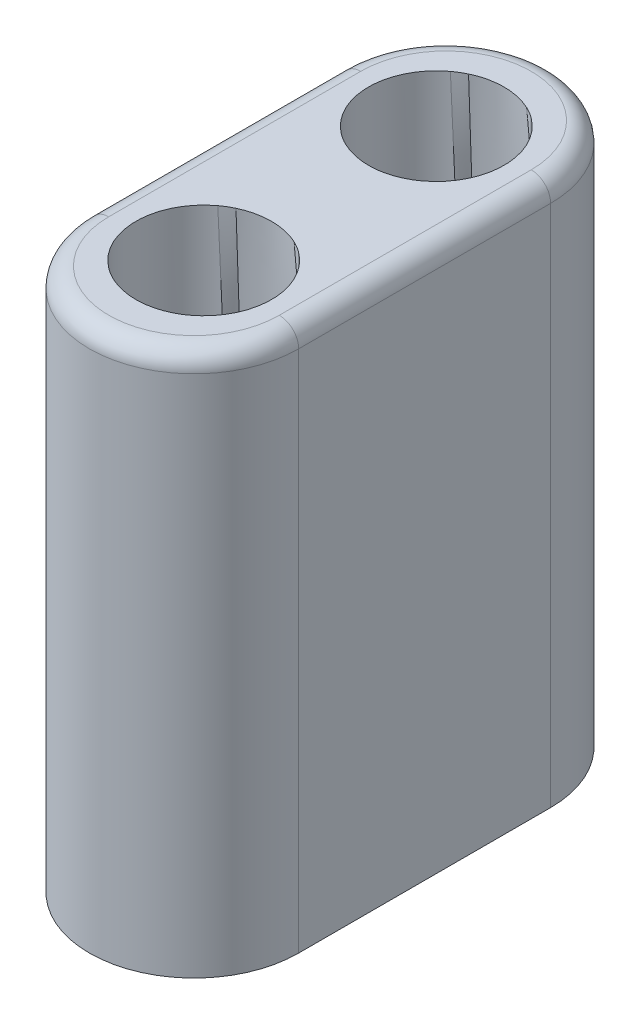
from build123d import *

# Parameters (mm, degrees)
BOSS_EXTRU_1_DEPTH      = 28
CONG_2_R                = 1
ESQUISSE3_R             = 3.5
ENL_V_MAT_EXTRU_3_DEPTH = 31.8993528
ESQUISSE6_W             = 3.6
ESQUISSE6_H             = 7.6
ENL_V_MAT_EXTRU_4_DEPTH = 23.243426154


with BuildPart() as part:
    # Esquisse1 → Boss.-Extru.1 (new body)
    with BuildSketch(Plane(origin=(0, 0, 0), x_dir=(1, 0, 0), z_dir=(0, 1, 0))):
        with BuildLine():
            Line((5.4, 6.5), (5.4, -6.5))
            ThreePointArc((5.4, -6.5), (0, -11.9), (-5.4, -6.5))
            Line((-5.4, -6.5), (-5.4, 6.5))
            ThreePointArc((-5.4, 6.5), (0, 11.9), (5.4, 6.5))
        make_face()
    extrude(amount=BOSS_EXTRU_1_DEPTH)

    # Congé2
    cong_2_edges = [part.edges().sort_by_distance(p)[0] for p in [
        (0, 28, 11.9),
        (5.4, 28, 0),
        (0, 28, -11.9),
        (-5.4, 28, 0),
    ]]
    fillet(cong_2_edges, radius=CONG_2_R)

    # Esquisse3 → Enlèv. mat.-Extru.3 (cut, through all)
    with BuildSketch(Plane(origin=(0, 28, 0), x_dir=(1, 0, 0), z_dir=(0, 1, 0))):
        with Locations(Location((0, -6, 0), (0, 0, 270))):
            Circle(ESQUISSE3_R)
    enl_v_mat_extru_3 = extrude(amount=-ENL_V_MAT_EXTRU_3_DEPTH, mode=Mode.SUBTRACT)

    # Esquisse5 for Enl_vement d → Enlèvement de matière-Lissage1 section 0
    with BuildSketch(Plane(origin=(0, 28, 0), x_dir=(1, 0, 0), z_dir=(0, 1, 0))):
        with BuildLine():
            # circular arc as an exact rational Bezier (weights 1, cos(half-angle), 1)
            Bezier((-1.498302207, -2.836917564), (0, -2.127195466), (1.498302207, -2.836917564), weights=[1, 0.903737839, 1])
            Bezier((1.498302207, -2.836917564), (8.17592068, -6), (1.498302207, -9.163082436), weights=[1, 0.428086345, 1])
            Bezier((1.498302207, -9.163082436), (0, -9.872804534), (-1.498302207, -9.163082436), weights=[1, 0.903737839, 1])
            Bezier((-1.498302207, -9.163082436), (-8.17592068, -6), (-1.498302207, -2.836917564), weights=[1, 0.428086345, 1])
        make_face()
    # Esquisse4 → Enlèvement de matière-Lissage1 section 1
    with BuildSketch(Plane(origin=(0, 18, 0), x_dir=(1, 0, 0), z_dir=(0, 1, 0))):
        with BuildLine():
            Line((-1.8, -2.2), (1.8, -2.2))
            Line((1.8, -2.2), (1.8, -9.8))
            Line((1.8, -9.8), (-1.8, -9.8))
            Line((-1.8, -9.8), (-1.8, -2.2))
        make_face()
    enl_vement_de_mati_re_lissage1 = loft(mode=Mode.SUBTRACT)

    # Esquisse6 → Enlèv. mat.-Extru.4 (cut, through all)
    with BuildSketch(Plane(origin=(0, 18, 0), x_dir=(1, 0, 0), z_dir=(0, 1, 0))):
        with Locations((0, -6)):
            Rectangle(ESQUISSE6_W, ESQUISSE6_H)
    enl_v_mat_extru_4 = extrude(amount=-ENL_V_MAT_EXTRU_4_DEPTH, mode=Mode.SUBTRACT)

    # Symétrie1: Enlèv. mat.-Extru.3, Enlèvement de matière-Lissage1, Enlèv. mat.-Extru.4 across plane
    add(enl_v_mat_extru_3.mirror(Plane.XY), mode=Mode.SUBTRACT)
    add(enl_vement_de_mati_re_lissage1.mirror(Plane.XY), mode=Mode.SUBTRACT)
    add(enl_v_mat_extru_4.mirror(Plane.XY), mode=Mode.SUBTRACT)


solid = part.part
